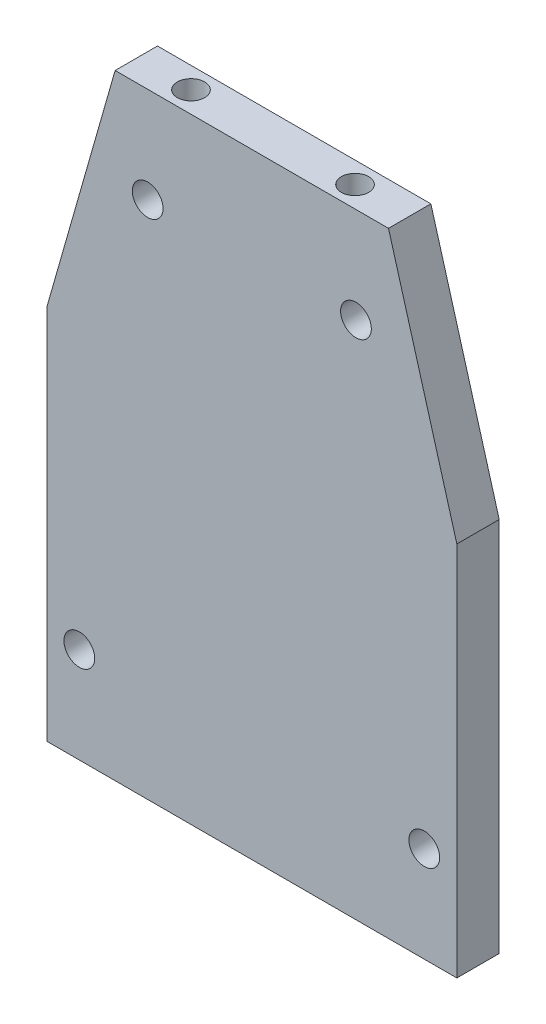
from build123d import *

# Parameters (mm, degrees)
EXTRUDE_1_4_DEPTH = 3.1
SKETCH4_R         = 2
M4_DRILL_DEPTH    = 8
SKETCH5_R         = 2
M4_DRILL2_DEPTH   = 8
SKETCH6_R         = 2.25
M4_THROUGH_DEPTH  = 6.2


with BuildPart() as part:
    # Sketch1 → 1/4 (new, symmetric)
    with BuildSketch(Plane.XY):
        Polygon((-20, 45), (20, 45), (30, 10), (30, -45), (-30, -45), (-30, 10), align=None)
    extrude(amount=EXTRUDE_1_4_DEPTH, both=True)

    # Sketch4 → M4_DRILL (cut)
    with BuildSketch(Plane(origin=(0, 45, 0), x_dir=(1, 0, 0), z_dir=(0, 1, 0))):
        with Locations(Location((-12, 0, 0), (0, 0, 180))):
            Circle(SKETCH4_R)
        with Locations((12, 0)):
            Circle(SKETCH4_R)
    extrude(amount=-M4_DRILL_DEPTH, mode=Mode.SUBTRACT)

    # Sketch5 → M4_DRILL2 (cut)
    with BuildSketch(Plane(origin=(0, -45, 0), x_dir=(-1, 0, 0), z_dir=(0, -1, 0))):
        with Locations(Location((-20, 0, 0), (0, 0, 180))):
            Circle(SKETCH5_R)
        with Locations((20, 0)):
            Circle(SKETCH5_R)
        with Locations(Location((0, 0, 0), (0, 0, 180))):
            Circle(SKETCH5_R)
    extrude(amount=-M4_DRILL2_DEPTH, mode=Mode.SUBTRACT)

    # Sketch6 → M4_through (cut)
    with BuildSketch(Plane.XY.offset(3.1)):
        with Locations((-25.2375, -31)):
            Circle(SKETCH6_R)
        with Locations((25.2375, -31)):
            Circle(SKETCH6_R)
        with Locations((-15.2375, 31)):
            Circle(SKETCH6_R)
        with Locations((15.2375, 31)):
            Circle(SKETCH6_R)
    extrude(amount=-M4_THROUGH_DEPTH, mode=Mode.SUBTRACT)


solid = part.part
